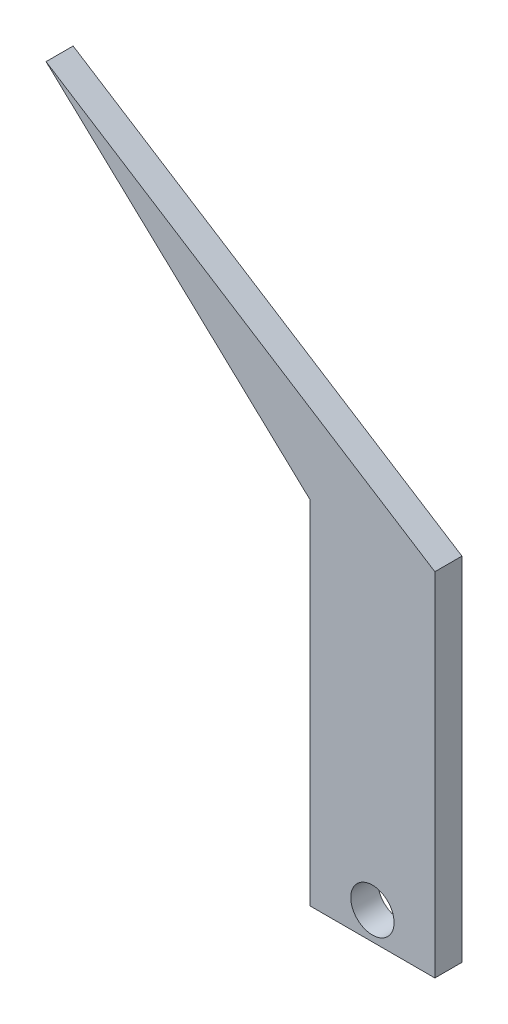
from build123d import *

# Parameters (mm, degrees)
EXTRUDE_1_DEPTH     = 5
SKETCH_2_R          = 4
CUT_EXTRUDE_1_DEPTH = 5
SKETCH_3_R          = 4
EXTRUDE_2_DEPTH     = 5


with BuildPart() as part:
    # 草图1 → 凸台-拉伸1 (new body)
    with BuildSketch(Plane.XY):
        Polygon((0, 0), (0, 65), (-48.75546427, 110.693878657), (23.07, 65), (23.07, 0), align=None)
    extrude(amount=EXTRUDE_1_DEPTH)

    # 草图2 → 切除-拉伸1 (cut)
    with BuildSketch(Plane.XY.offset(5)):
        with Locations((11.535, 5.104320519)):
            Circle(SKETCH_2_R)
        with Locations(Location((11.535, 59.895679481, 0), (0, 0, 180))):
            Circle(SKETCH_2_R)
    extrude(amount=-CUT_EXTRUDE_1_DEPTH, mode=Mode.SUBTRACT)

    # 草图3 → 凸台-拉伸2 (add)
    with BuildSketch(Plane.XY.offset(5)):
        with Locations((11.535, 59.895679481)):
            Circle(SKETCH_3_R)
    extrude(amount=-EXTRUDE_2_DEPTH)


solid = part.part
